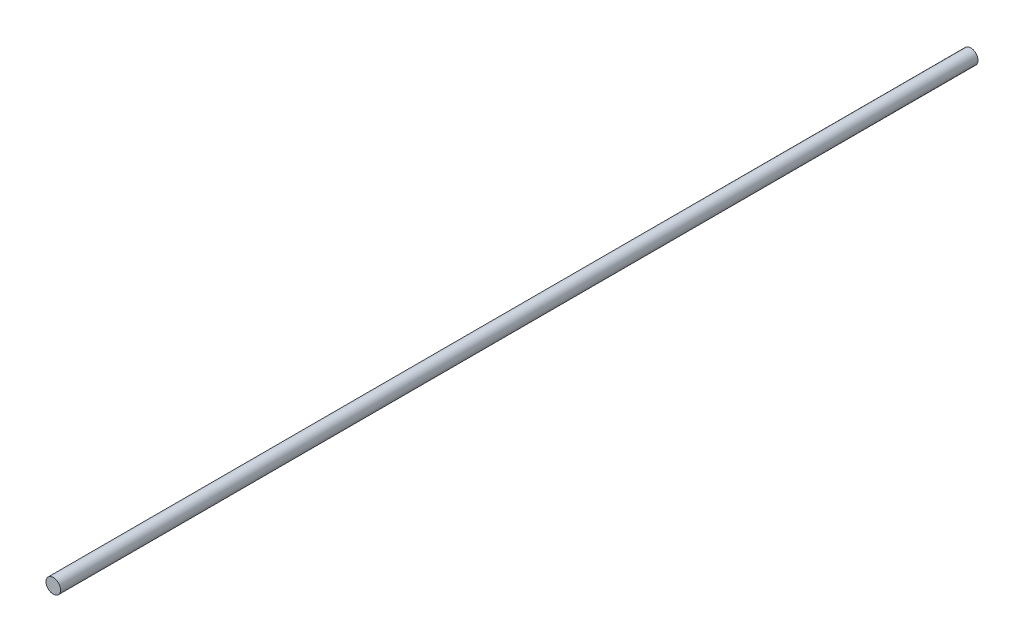
from build123d import *

# Parameters (mm, degrees)
CROQUIS1_R              = 3.175
SALIENTE_EXTRUIR1_DEPTH = 400


with BuildPart() as part:
    # Croquis1 → Saliente-Extruir1 (new body)
    with BuildSketch(Plane.XY):
        Circle(CROQUIS1_R)
    extrude(amount=SALIENTE_EXTRUIR1_DEPTH)


solid = part.part
